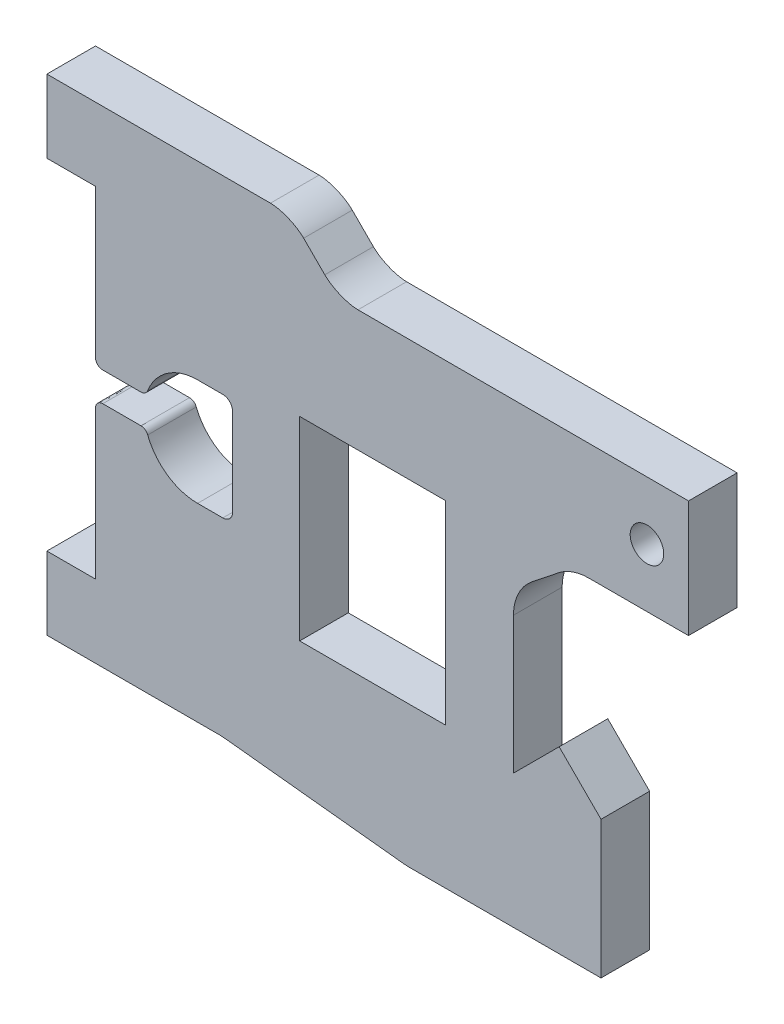
from build123d import *

# Parameters (mm, degrees)
MODEL_4_W           = 14.999999996
MODEL_4_H           = 19.999999994
MODEL_4_R           = 1.725
BOSS_EXTRUDE3_DEPTH = 5


with BuildPart() as part:
    # Model<4> → Boss-Extrude3 (new body)
    with BuildSketch(Plane.XY):
        with BuildLine():
            Line((159.088901233, 42.770886007), (159.088901233, 54.770886004))
            Line((159.088901233, 54.770886004), (125.08858378, 54.795139347))
            add(Edge.make_bspline(
                [(121.67437012, 56.209353091), (122.452187569, 55.431535532), (123.988583716, 54.795139347), (125.08858378, 54.795139347)],
                knots=[36, 36, 36, 36, 37, 37, 37, 37], degree=3))
            Line((121.67437012, 56.209353091), (119.502797904, 58.380925601))
            add(Edge.make_bspline(
                [(116.088583489, 59.795139659), (117.188583796, 59.795139659), (118.724980283, 59.158743333), (119.502797904, 58.380925601)],
                knots=[34, 34, 34, 34, 35, 35, 35, 35], degree=3))
            Line((116.088583489, 59.795139659), (93.088622023, 59.795139659))
            Line((93.088622023, 59.795139659), (93.088622023, 52.295139183))
            Line((93.088622023, 52.295139183), (98.088808744, 52.295139183))
            Line((98.088808744, 52.295139183), (98.088808744, 37.055828853))
            add(Edge.make_bspline(
                [(98.838842522, 36.30582961), (98.424615889, 36.305810532), (98.088808739, 36.64160222), (98.088808744, 37.055828853)],
                knots=[29, 29, 29, 29, 30, 30, 30, 30], degree=3))
            Line((98.838842522, 36.30582961), (102.763213768, 36.306010412))
            add(Edge.make_bspline(
                [(103.458228599, 36.781634874), (103.346863397, 36.494660115), (103.071039563, 36.306024593), (102.763213768, 36.306010412)],
                knots=[27, 27, 27, 27, 28, 28, 28, 28], degree=3))
            add(Edge.make_bspline(
                [(108.589100574, 40.305794491), (106.259590893, 40.305794491), (104.256249253, 38.838038305), (103.458228599, 36.781634874)],
                knots=[26, 26, 26, 26, 27, 27, 27, 27], degree=3))
            Line((108.589100574, 40.305794491), (111.188773507, 40.305794491))
            add(Edge.make_bspline(
                [(112.188773507, 39.305794492), (112.188773506, 39.858079241), (111.741058256, 40.305794491), (111.188773507, 40.305794491)],
                knots=[24, 24, 24, 24, 25, 25, 25, 25], degree=3))
            Line((112.188773507, 39.305794492), (112.188773507, 30.305794494))
            add(Edge.make_bspline(
                [(111.188773507, 29.305794495), (111.741058256, 29.305794495), (112.188773507, 29.753509745), (112.188773507, 30.305794494)],
                knots=[22, 22, 22, 22, 23, 23, 23, 23], degree=3))
            Line((111.188773507, 29.305794495), (108.589100574, 29.305794495))
            add(Edge.make_bspline(
                [(103.458534777, 32.829165314), (104.256761577, 30.773175353), (106.259888758, 29.305794495), (108.589100574, 29.305794495)],
                knots=[20, 20, 20, 20, 21, 21, 21, 21], degree=3))
            add(Edge.make_bspline(
                [(102.763713878, 33.304665432), (103.071437534, 33.304591066), (103.347162069, 33.116027604), (103.458534777, 32.829165314)],
                knots=[19, 19, 19, 19, 20, 20, 20, 20], degree=3))
            Line((102.763713878, 33.304665432), (98.838989216, 33.305613899))
            add(Edge.make_bspline(
                [(98.088808744, 32.555614676), (98.088808739, 32.969898599), (98.424705306, 33.30571401), (98.838989216, 33.305613899)],
                knots=[17, 17, 17, 17, 18, 18, 18, 18], degree=3))
            Line((98.088808744, 32.555614676), (98.088808744, 17.30579417))
            Line((98.088808744, 17.30579417), (93.088622023, 17.30579417))
            Line((93.088622023, 17.30579417), (93.088622023, 9.805793695))
            add(Edge.make_bspline(
                [(110.8243856, 9.805786903), (108.600397254, 9.805793694), (93.088622023, 9.805793695)],
                knots=[13, 13, 13, 14, 14, 14], degree=2))
            add(Edge.make_bspline(
                [(111.354083681, 9.777355295), (111.177236079, 9.796295653), (111.002244565, 9.80578636), (110.8243856, 9.805786903)],
                knots=[12, 12, 12, 12, 13, 13, 13, 13], degree=3))
            Line((111.354083681, 9.777355295), (129.823433077, 7.799317277))
            add(Edge.make_bspline(
                [(130.355887494, 7.770885671), (130.178023326, 7.770885671), (130.000285852, 7.780376365), (129.823433077, 7.799317277)],
                knots=[10, 10, 10, 10, 11, 11, 11, 11], degree=3))
            Line((130.355887494, 7.770885671), (150.088901196, 7.770885671))
            Line((150.088901196, 7.770885671), (150.088901196, 21.91055044))
            Line((150.088901196, 21.91055044), (145.783498532, 26.215953035))
            Line((145.783498532, 26.215953035), (141.088901059, 21.521355488))
            Line((141.088901059, 21.521355488), (141.088901059, 35.589646165))
            add(Edge.make_bspline(
                [(142.978129629, 39.504119451), (141.78451535, 38.555572629), (141.088901059, 37.114262879), (141.088901059, 35.589646165)],
                knots=[4, 4, 4, 4, 5, 5, 5, 5], degree=3))
            Line((142.978129629, 39.504119451), (145.722916781, 41.685359384))
            add(Edge.make_bspline(
                [(148.833688241, 42.770886007), (147.703902982, 42.770886039), (146.607419644, 42.388260099), (145.722916781, 41.685359384)],
                knots=[2, 2, 2, 2, 3, 3, 3, 3], degree=3))
            Line((148.833688241, 42.770886007), (159.088901233, 42.770886007))
        make_face()
        with Locations((126.592244968, 32.300466217)):
            Rectangle(MODEL_4_W, MODEL_4_H, mode=Mode.SUBTRACT)
        with Locations((154.813901136, 48.770885771)):
            Circle(MODEL_4_R, mode=Mode.SUBTRACT)
    extrude(amount=BOSS_EXTRUDE3_DEPTH)


solid = part.part
